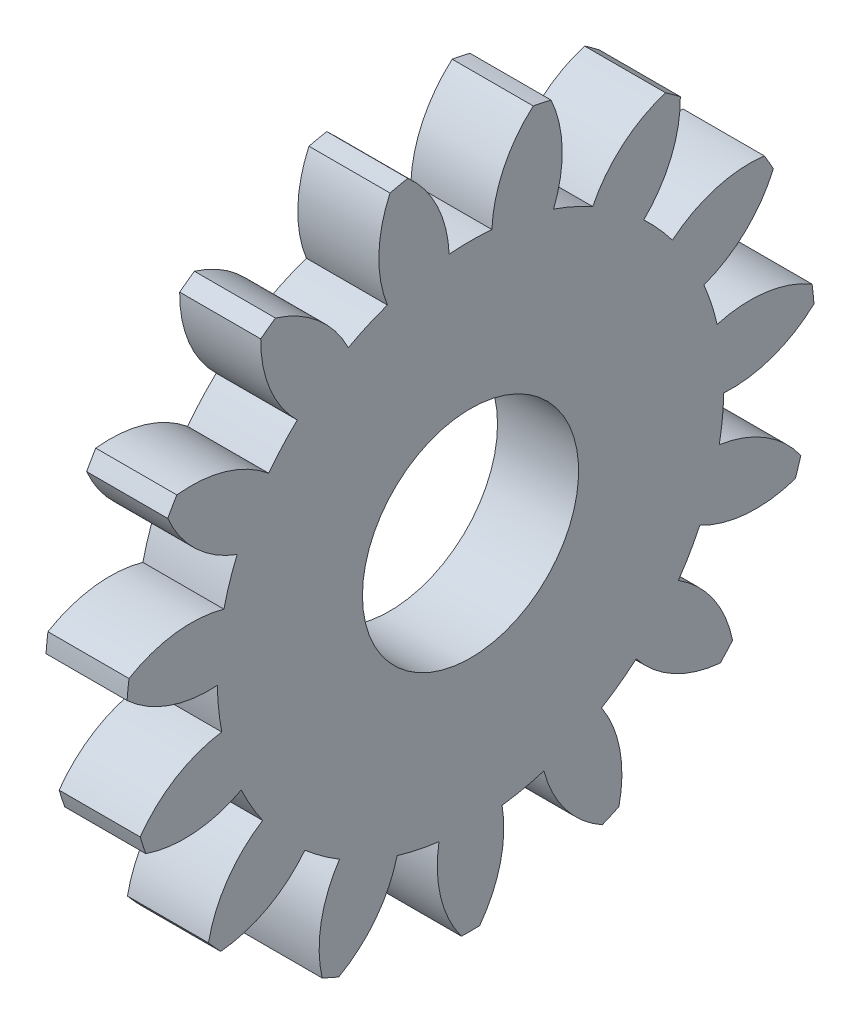
from build123d import *

# Parameters (mm, degrees)
BASPROSKE_W     = 3
BASPROSKE_H     = 12.75
TOOTHCUT_DEPTH  = 19.27908641
TEETHCUTS_COUNT = 15
TEETHCUTS_ANGLE = 336
BORSKE_R        = 4
BORE_DEPTH      = 50.0000508


with BuildPart() as part:
    # BasProSke → Base-Revolve (revolve)
    with BuildSketch(Plane(origin=(0, 0, 0), x_dir=(1, 0, 0), z_dir=(0, 1, 0)), mode=Mode.PRIVATE) as base_revolve_sk:
        with Locations((1.5, 6.375)):
            Rectangle(BASPROSKE_W, BASPROSKE_H)
    revolve(base_revolve_sk.sketch.rotate(Axis((-10, 0, 0), (1, 0, 0)), 180), axis=Axis((-10, 0, 0), (1, 0, 0)))

    # TooCutSke → ToothCut (cut, through all)
    with BuildSketch(Plane(origin=(0, 0, 0), x_dir=(0, 0, -1), z_dir=(1, 0, 0))):
        with BuildLine():
            ThreePointArc((0.791546546, 9.340520867), (0, 9.374), (-0.791546546, 9.340520867))
            ThreePointArc((-0.791546546, 9.340520867), (-1.235070734, 11.110218102), (-2.344732916, 12.558386549))
            ThreePointArc((-2.344732916, 12.558386549), (0, 12.7754), (2.344732916, 12.558386549))
            ThreePointArc((2.344732916, 12.558386549), (1.235070734, 11.110218102), (0.791546546, 9.340520867))
        make_face()
    toothcut = extrude(amount=TOOTHCUT_DEPTH, mode=Mode.SUBTRACT)

    # TeethCuts: ToothCut ×15 about axis
    teethcuts_axis = Axis((-10, 0, 0), (1, 0, 0))
    for i in range(1, TEETHCUTS_COUNT):
        add(toothcut.rotate(teethcuts_axis, i * TEETHCUTS_ANGLE / (TEETHCUTS_COUNT - 1)), mode=Mode.SUBTRACT)

    # BorSke → Bore (cut, symmetric)
    with BuildSketch(Plane(origin=(0, 0, 0), x_dir=(0, 0, -1), z_dir=(1, 0, 0))):
        with Locations(Location((0, 0, 0), (0, 0, 180))):
            Circle(BORSKE_R)
    extrude(amount=BORE_DEPTH, both=True, mode=Mode.SUBTRACT)


solid = part.part
